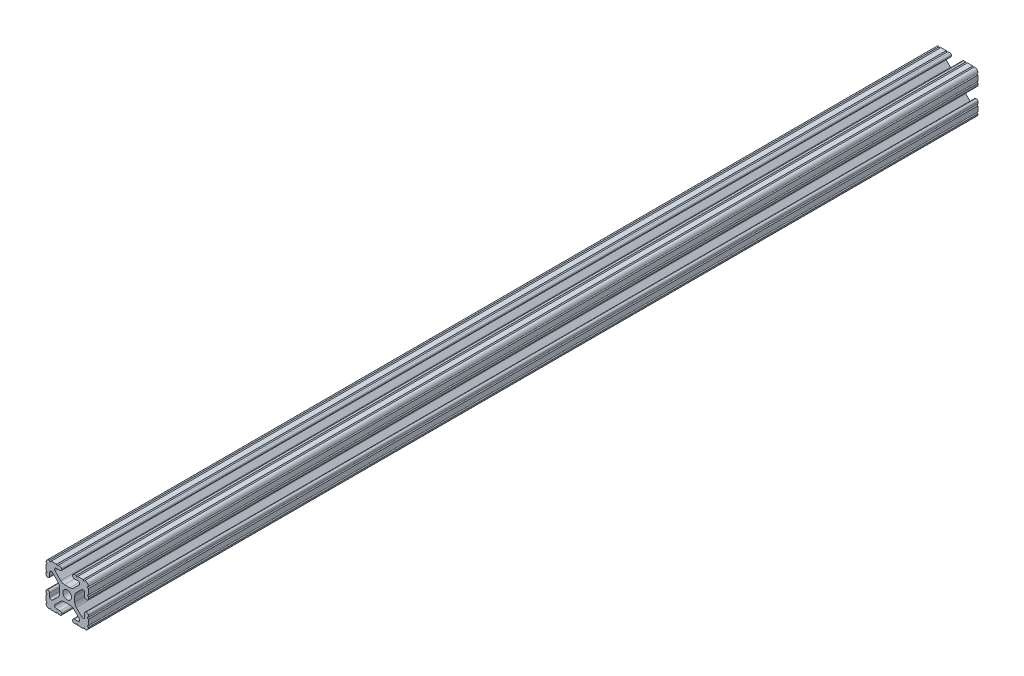
from build123d import *

# Parameters (mm, degrees)
SKETCH1_R           = 2.6035
BOSS_EXTRUDE1_DEPTH = 266.7


with BuildPart() as part:
    # Sketch1 → Boss-Extrude1 (new, symmetric)
    with BuildSketch(Plane.XY):
        with BuildLine():
            Line((-7.179650497, -8.645192506), (-3.952270251, -5.423690499))
            ThreePointArc((-3.952270251, -5.423690499), (-2.922936451, -4.736929036), (-1.709253557, -4.4958))
            Line((-1.709253557, -4.4958), (1.709253557, -4.4958))
            ThreePointArc((1.709253557, -4.4958), (2.922936451, -4.736929036), (3.952270251, -5.423690499))
            Line((3.952270251, -5.423690499), (7.179650497, -8.645192506))
            ThreePointArc((7.179650497, -8.645192506), (7.41473083, -9.822813117), (6.416408329, -10.4902))
            Line((6.416408329, -10.4902), (4.287512407, -10.4902))
            ThreePointArc((4.287512407, -10.4902), (3.54574862, -10.79744862), (3.2385, -11.539212407))
            Line((3.2385, -11.539212407), (3.2385, -11.650987593))
            ThreePointArc((3.2385, -11.650987593), (3.54574862, -12.39275138), (4.287512407, -12.7))
            Line((4.287512407, -12.7), (5.317126718, -12.7))
            ThreePointArc((5.317126718, -12.7), (5.825126718, -12.192), (6.333126718, -12.7))
            Line((6.333126718, -12.7), (9.550443118, -12.7))
            ThreePointArc((9.550443118, -12.7), (10.058366869, -12.192000006), (10.566443095, -12.699847501))
            ThreePointArc((10.566443095, -12.699847501), (12.082537762, -12.08250727), (12.699846982, -10.566399977))
            ThreePointArc((12.699846982, -10.566399977), (12.192000006, -10.058323491), (12.7, -9.5504))
            Line((12.7, -9.5504), (12.7, -6.3330836))
            ThreePointArc((12.7, -6.3330836), (12.192, -5.8250836), (12.7, -5.3170836))
            Line((12.7, -5.3170836), (12.7, -4.287469289))
            ThreePointArc((12.7, -4.287469289), (12.39275138, -3.545705502), (11.650987593, -3.238456882))
            Line((11.650987593, -3.238456882), (11.539212407, -3.238456882))
            ThreePointArc((11.539212407, -3.238456882), (10.79744862, -3.545705502), (10.4902, -4.287469289))
            Line((10.4902, -4.287469289), (10.4902, -6.402089023))
            ThreePointArc((10.4902, -6.402089023), (9.856505071, -7.351067942), (8.737131347, -7.129408934))
            Line((8.737131347, -7.129408934), (5.441005833, -3.840816462))
            ThreePointArc((5.441005833, -3.840816462), (4.750877967, -2.809883091), (4.5085, -1.593185507))
            Line((4.5085, -1.593185507), (4.5085, 1.593185507))
            ThreePointArc((4.5085, 1.593185507), (4.750877967, 2.809883091), (5.441005833, 3.840816462))
            Line((5.441005833, 3.840816462), (8.737131347, 7.129408934))
            ThreePointArc((8.737131347, 7.129408934), (9.856505071, 7.351067942), (10.4902, 6.402089023))
            Line((10.4902, 6.402089023), (10.4902, 4.287469289))
            ThreePointArc((10.4902, 4.287469289), (10.79744862, 3.545705502), (11.539212407, 3.238456882))
            Line((11.539212407, 3.238456882), (11.650987593, 3.238456882))
            ThreePointArc((11.650987593, 3.238456882), (12.39275138, 3.545705502), (12.7, 4.287469289))
            Line((12.7, 4.287469289), (12.7, 5.3170836))
            ThreePointArc((12.7, 5.3170836), (12.192, 5.8250836), (12.7, 6.3330836))
            Line((12.7, 6.3330836), (12.7, 9.5504))
            ThreePointArc((12.7, 9.5504), (12.192000006, 10.058323491), (12.699846982, 10.566399977))
            ThreePointArc((12.699846982, 10.566399977), (12.082537762, 12.08250727), (10.566443095, 12.699847501))
            ThreePointArc((10.566443095, 12.699847501), (10.058366869, 12.192000006), (9.550443118, 12.7))
            Line((9.550443118, 12.7), (6.333126718, 12.7))
            ThreePointArc((6.333126718, 12.7), (5.825126718, 12.192), (5.317126718, 12.7))
            Line((5.317126718, 12.7), (4.287512407, 12.7))
            ThreePointArc((4.287512407, 12.7), (3.54574862, 12.39275138), (3.2385, 11.650987593))
            Line((3.2385, 11.650987593), (3.2385, 11.539212407))
            ThreePointArc((3.2385, 11.539212407), (3.54574862, 10.79744862), (4.287512407, 10.4902))
            Line((4.287512407, 10.4902), (6.476788598, 10.4902))
            ThreePointArc((6.476788598, 10.4902), (7.432222385, 9.85140422), (7.207036008, 8.724370562))
            Line((7.207036008, 8.724370562), (3.898272566, 5.423169045))
            ThreePointArc((3.898272566, 5.423169045), (2.869120213, 4.736787962), (1.655778399, 4.4958))
            Line((1.655778399, 4.4958), (-1.655778399, 4.4958))
            ThreePointArc((-1.655778399, 4.4958), (-2.869120213, 4.736787962), (-3.898272566, 5.423169045))
            Line((-3.898272566, 5.423169045), (-7.207036008, 8.724370562))
            ThreePointArc((-7.207036008, 8.724370562), (-7.432222385, 9.85140422), (-6.476788598, 10.4902))
            Line((-6.476788598, 10.4902), (-4.287512407, 10.4902))
            ThreePointArc((-4.287512407, 10.4902), (-3.54574862, 10.79744862), (-3.2385, 11.539212407))
            Line((-3.2385, 11.539212407), (-3.2385, 11.650987593))
            ThreePointArc((-3.2385, 11.650987593), (-3.54574862, 12.39275138), (-4.287512407, 12.7))
            Line((-4.287512407, 12.7), (-5.317126718, 12.7))
            ThreePointArc((-5.317126718, 12.7), (-5.825126718, 12.192), (-6.333126718, 12.7))
            Line((-6.333126718, 12.7), (-9.550443118, 12.7))
            ThreePointArc((-9.550443118, 12.7), (-10.058366869, 12.192000006), (-10.566443095, 12.699847501))
            ThreePointArc((-10.566443095, 12.699847501), (-12.082537762, 12.08250727), (-12.699846982, 10.566399977))
            ThreePointArc((-12.699846982, 10.566399977), (-12.192000006, 10.058323491), (-12.7, 9.5504))
            Line((-12.7, 9.5504), (-12.7, 6.3330836))
            ThreePointArc((-12.7, 6.3330836), (-12.192, 5.8250836), (-12.7, 5.3170836))
            Line((-12.7, 5.3170836), (-12.7, 4.287469289))
            ThreePointArc((-12.7, 4.287469289), (-12.39275138, 3.545705502), (-11.650987593, 3.238456882))
            Line((-11.650987593, 3.238456882), (-11.539212407, 3.238456882))
            ThreePointArc((-11.539212407, 3.238456882), (-10.79744862, 3.545705502), (-10.4902, 4.287469289))
            Line((-10.4902, 4.287469289), (-10.4902, 6.402089023))
            ThreePointArc((-10.4902, 6.402089023), (-9.856505071, 7.351067942), (-8.737131347, 7.129408934))
            Line((-8.737131347, 7.129408934), (-5.441005833, 3.840816462))
            ThreePointArc((-5.441005833, 3.840816462), (-4.750877967, 2.809883091), (-4.5085, 1.593185507))
            Line((-4.5085, 1.593185507), (-4.5085, -1.593185507))
            ThreePointArc((-4.5085, -1.593185507), (-4.750877967, -2.809883091), (-5.441005833, -3.840816462))
            Line((-5.441005833, -3.840816462), (-8.737131347, -7.129408934))
            ThreePointArc((-8.737131347, -7.129408934), (-9.856505071, -7.351067942), (-10.4902, -6.402089023))
            Line((-10.4902, -6.402089023), (-10.4902, -4.287469289))
            ThreePointArc((-10.4902, -4.287469289), (-10.79744862, -3.545705502), (-11.539212407, -3.238456882))
            Line((-11.539212407, -3.238456882), (-11.650987593, -3.238456882))
            ThreePointArc((-11.650987593, -3.238456882), (-12.39275138, -3.545705502), (-12.7, -4.287469289))
            Line((-12.7, -4.287469289), (-12.7, -5.3170836))
            ThreePointArc((-12.7, -5.3170836), (-12.192, -5.8250836), (-12.7, -6.3330836))
            Line((-12.7, -6.3330836), (-12.7, -9.5504))
            ThreePointArc((-12.7, -9.5504), (-12.192000006, -10.058323491), (-12.699846982, -10.566399977))
            ThreePointArc((-12.699846982, -10.566399977), (-12.082537762, -12.08250727), (-10.566443095, -12.699847501))
            ThreePointArc((-10.566443095, -12.699847501), (-10.058366869, -12.192000006), (-9.550443118, -12.7))
            Line((-9.550443118, -12.7), (-6.333126718, -12.7))
            ThreePointArc((-6.333126718, -12.7), (-5.825126718, -12.192), (-5.317126718, -12.7))
            Line((-5.317126718, -12.7), (-4.287512407, -12.7))
            ThreePointArc((-4.287512407, -12.7), (-3.54574862, -12.39275138), (-3.2385, -11.650987593))
            Line((-3.2385, -11.650987593), (-3.2385, -11.539212407))
            ThreePointArc((-3.2385, -11.539212407), (-3.54574862, -10.79744862), (-4.287512407, -10.4902))
            Line((-4.287512407, -10.4902), (-6.416408329, -10.4902))
            ThreePointArc((-6.416408329, -10.4902), (-7.41473083, -9.822813117), (-7.179650497, -8.645192506))
        make_face()
        Circle(SKETCH1_R, mode=Mode.SUBTRACT)
    extrude(amount=BOSS_EXTRUDE1_DEPTH, both=True)


solid = part.part
